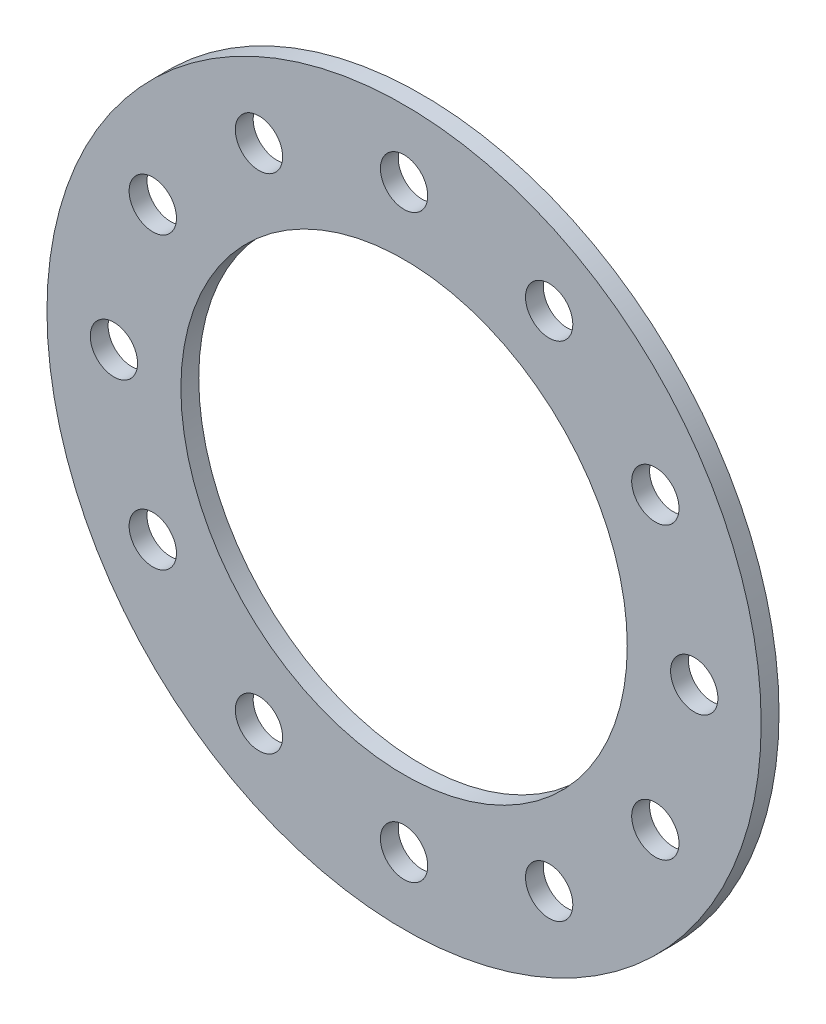
from build123d import *

# Parameters (mm, degrees)
SKETCH1_R            = 40
SKETCH1_R_2          = 25
BOSS_EXTRUDE1_DEPTH  = 2
M5_CLEARANCE_HOLE1_D = 5.3
CIRPATTERN1_COUNT    = 12


with BuildPart() as part:
    # Sketch1 → Boss-Extrude1 (new body)
    with BuildSketch(Plane.XY):
        Circle(SKETCH1_R)
        Circle(SKETCH1_R_2, mode=Mode.SUBTRACT)
    extrude(amount=BOSS_EXTRUDE1_DEPTH)

    # M5 Clearance Hole1 (through all)
    with Locations(Plane.XY.offset(2)):
        with Locations((0, 32.5)):
            m5_clearance_hole1 = Hole(M5_CLEARANCE_HOLE1_D / 2)

    # CirPattern1: M5 Clearance Hole1 ×12 about axis
    cirpattern1_axis = Axis((0, 0, 0), (0, 0, 1))
    for i in range(1, CIRPATTERN1_COUNT):
        add(m5_clearance_hole1.rotate(cirpattern1_axis, i * 360 / CIRPATTERN1_COUNT), mode=Mode.SUBTRACT)


solid = part.part
